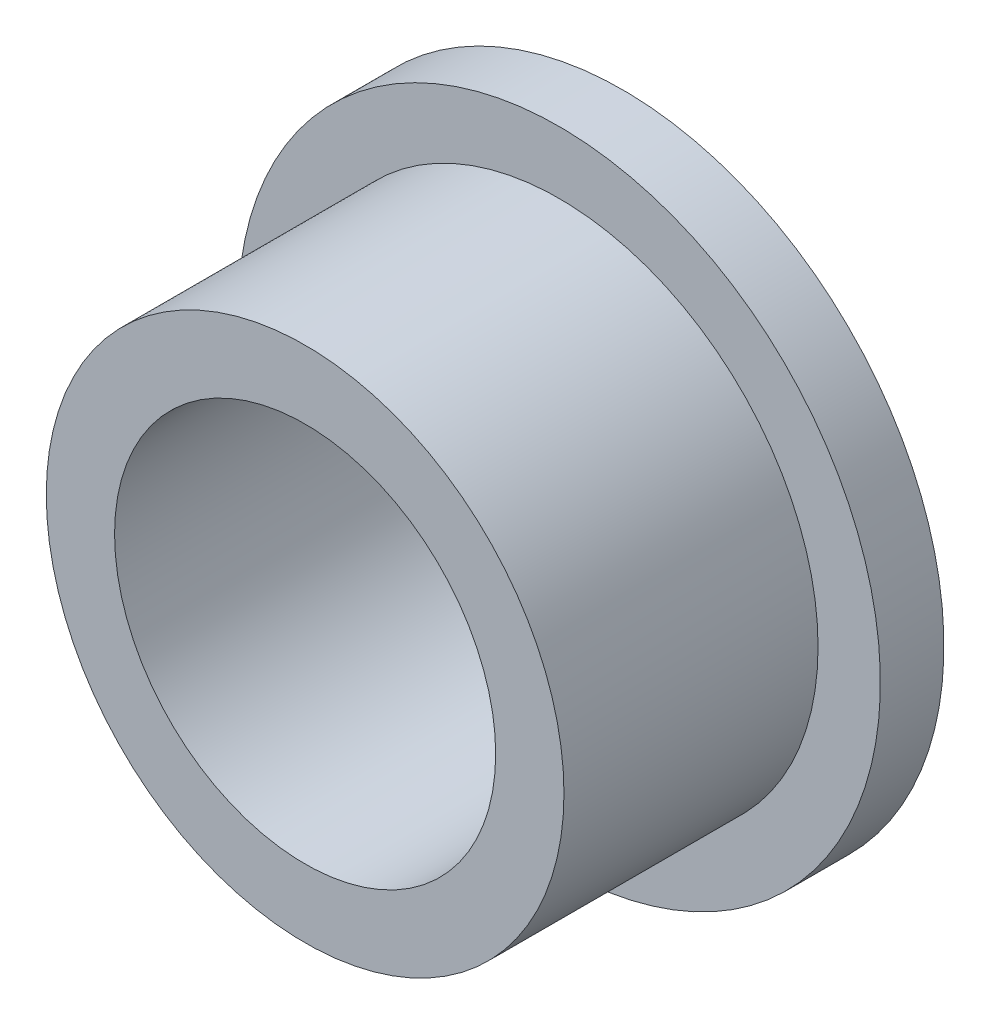
from build123d import *

# Parameters (mm, degrees)
SKETCH_1_R      = 4.075
SKETCH_1_R_2    = 3
EXTRUDE_4_DEPTH = 5
SKETCH_7_R      = 5.056218796
SKETCH_7_R_2    = 4.075
EXTRUDE_5_DEPTH = 1


with BuildPart() as part:
    # 草图1 → 凸台-拉伸4 (new body)
    with BuildSketch(Plane.XY):
        Circle(SKETCH_1_R)
        Circle(SKETCH_1_R_2, mode=Mode.SUBTRACT)
    extrude(amount=EXTRUDE_4_DEPTH)

    # 草图7 → 凸台-拉伸5 (add)
    with BuildSketch(Plane(origin=(0, 0, 0), x_dir=(-1, 0, 0), z_dir=(0, 0, -1))):
        Circle(SKETCH_7_R)
        Circle(SKETCH_7_R_2, mode=Mode.SUBTRACT)
    extrude(amount=-EXTRUDE_5_DEPTH)


solid = part.part
